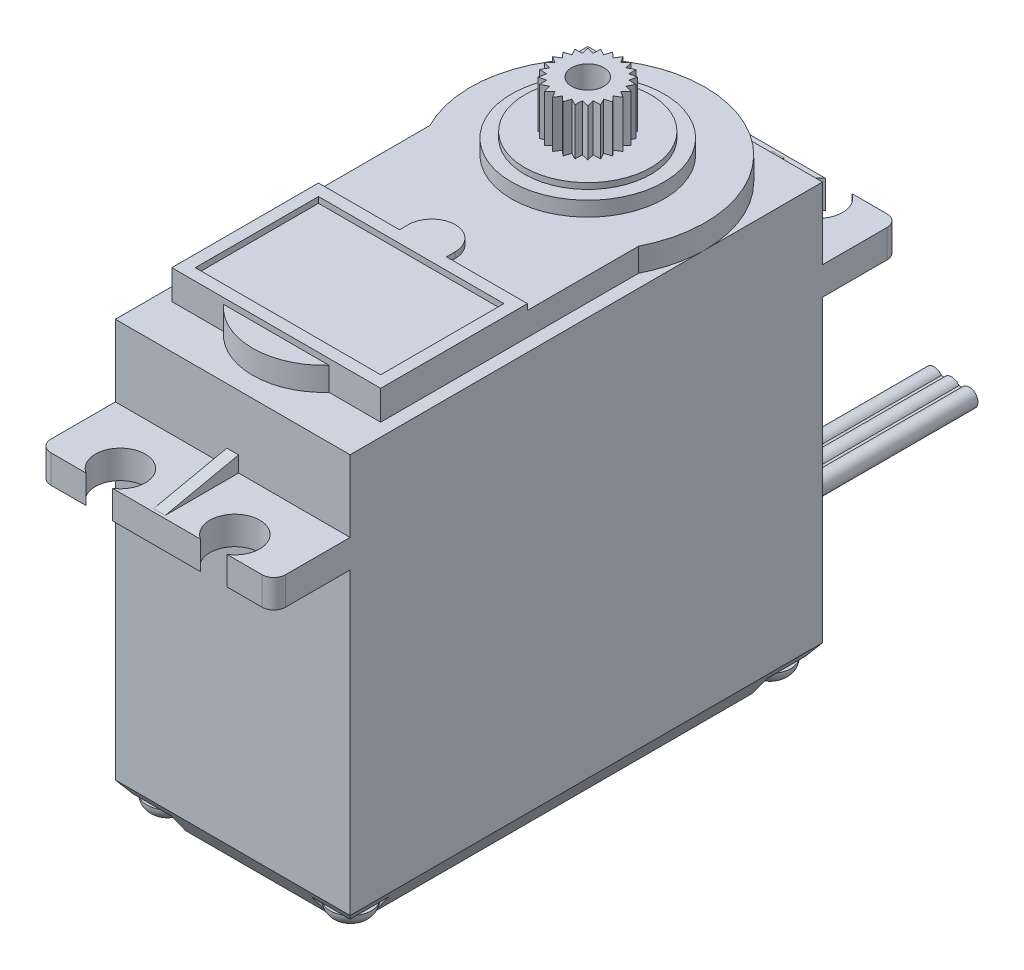
from build123d import *

# Parameters (mm, degrees)
SKETCH1_W            = 20
SKETCH1_H            = 40.25
BOSS_EXTRUDE1_DEPTH  = 18.375
BOSS_EXTRUDE2_DEPTH  = 2.4
BOSS_EXTRUDE3_DEPTH  = 0.5
BOSS_EXTRUDE4_DEPTH  = 2
SKETCH5_R            = 6.5
BOSS_EXTRUDE5_DEPTH  = 1.75
CUT_EXTRUDE1_START   = -0.5
SKETCH6_R            = 6.5
SKETCH6_R_2          = 5.375
CUT_EXTRUDE1_DEPTH   = 0.5
BOSS_EXTRUDE6_DEPTH  = 4
SKETCH8_R            = 1.375
CUT_EXTRUDE2_DEPTH   = 6
BOSS_EXTRUDE7_DEPTH  = 0.5
FILLET1_R            = 1
FILLET1_OF_MIRROR1_R = 1
CHAMFER1_SIZE        = 2
CHAMFER1_SIZE2       = 2.75
CUT_EXTRUDE3_DEPTH   = 1.75
MIRROR3_COPY_1_DEPTH = 1.75
MIRROR3_COPY_3_DEPTH = 1.75
SKETCH13_W           = 6.5
SKETCH13_H           = 4.25
BOSS_EXTRUDE8_DEPTH  = 1
BOSS_EXTRUDE10_DEPTH = 20


with BuildPart() as part:
    # Sketch1 → Boss-Extrude1 (new, symmetric)
    with BuildSketch(Plane(origin=(0, 0, 0), x_dir=(1, 0, 0), z_dir=(0, 1, 0))):
        Rectangle(SKETCH1_W, SKETCH1_H)
    extrude(amount=BOSS_EXTRUDE1_DEPTH, both=True)

    # Sketch2 → Boss-Extrude2 (add)
    with BuildSketch(Plane(origin=(0, 9.874999982, 0), x_dir=(1, 0, 0), z_dir=(0, 1, 0))):
        with BuildLine():
            Line((-10, -20.125), (-10, -26.625))
            Line((-10, -26.625), (-6, -26.625))
            ThreePointArc((-6, -26.625), (-4.875, -22.697224362), (-3.75, -26.625))
            Line((-3.75, -26.625), (3.75, -26.625))
            ThreePointArc((3.75, -26.625), (4.875, -22.697224362), (6, -26.625))
            Line((6, -26.625), (10, -26.625))
            Line((10, -26.625), (10, -20.125))
            Line((10, -20.125), (-10, -20.125))
        make_face()
    boss_extrude2 = extrude(amount=BOSS_EXTRUDE2_DEPTH)

    # Sketch3 → Boss-Extrude3 (add, symmetric)
    with BuildSketch(Plane(origin=(0, 0, 0), x_dir=(0, 0, -1), z_dir=(1, 0, 0))):
        Polygon((-20.125, 13.614999982), (-26.375, 12.274999982), (-20.125, 12.274999982), align=None)
    boss_extrude3 = extrude(amount=BOSS_EXTRUDE3_DEPTH, both=True)

    # Sketch4 → Boss-Extrude4 (add)
    with BuildSketch(Plane(origin=(0, 18.375, 0), x_dir=(1, 0, 0), z_dir=(0, 1, 0))):
        with BuildLine():
            ThreePointArc((-10, 10.125), (-9.721111048, 7.77979212), (-8.9, 5.565394754))
            Line((-8.9, 5.565394754), (-8.9, -16.418999275))
            Line((-8.9, -16.418999275), (-4.5, -16.418999275))
            ThreePointArc((-4.5, -16.418999275), (0, -18.418999275), (4.5, -16.418999275))
            Line((4.5, -16.418999275), (8.9, -16.418999275))
            Line((8.9, -16.418999275), (8.9, 5.565394754))
            ThreePointArc((8.9, 5.565394754), (9.721111051, 7.779792133), (10, 10.125000027))
            ThreePointArc((10, 10.125000027), (7.071067802, 17.196067821), (0, 20.125))
            ThreePointArc((0, 20.125), (-7.071067812, 17.196067812), (-10, 10.125))
        make_face()
    extrude(amount=BOSS_EXTRUDE4_DEPTH)

    # Sketch5 → Boss-Extrude5 (add)
    with BuildSketch(Plane(origin=(0, 20.375, 0), x_dir=(1, 0, 0), z_dir=(0, 1, 0))):
        with Locations((0, 10.125)):
            Circle(SKETCH5_R)
    extrude(amount=BOSS_EXTRUDE5_DEPTH)

    # Sketch6 → Cut-Extrude1 (cut)
    with BuildSketch(Plane(origin=(0, 22.125, 0), x_dir=(1, 0, 0), z_dir=(0, 1, 0)).offset(CUT_EXTRUDE1_START)):
        with Locations((0, 10.125)):
            Circle(SKETCH6_R)
        with Locations((0, 10.125)):
            Circle(SKETCH6_R_2, mode=Mode.SUBTRACT)
    extrude(amount=CUT_EXTRUDE1_DEPTH, mode=Mode.SUBTRACT)

    # Sketch7 → Boss-Extrude6 (add)
    with BuildSketch(Plane(origin=(0, 22.125, 0), x_dir=(1, 0, 0), z_dir=(0, 1, 0))):
        Polygon((0, 13.125), (-0.326315481, 12.603612153), (-0.776457135, 13.022777479), (-0.956708581, 12.434698831), (-1.5, 12.723076211), (-1.521903573, 12.108383351), (-2.121320344, 12.246320344), (-1.983383351, 11.646903573), (-2.598076211, 11.625), (-2.309698831, 11.081708581), (-2.897777479, 10.901457135), (-2.478612153, 10.451315481), (-3, 10.125), (-2.478612153, 9.798684519), (-2.897777479, 9.348542865), (-2.309698831, 9.168291419), (-2.598076211, 8.625), (-1.983383351, 8.603096427), (-2.121320344, 8.003679656), (-1.521903573, 8.141616649), (-1.5, 7.526923789), (-0.956708581, 7.815301169), (-0.776457135, 7.227222521), (-0.326315481, 7.646387847), (0, 7.125), (0.326315481, 7.646387847), (0.776457135, 7.227222521), (0.956708581, 7.815301169), (1.5, 7.526923789), (1.521903573, 8.141616649), (2.121320344, 8.003679656), (1.983383351, 8.603096427), (2.598076211, 8.625), (2.309698831, 9.168291419), (2.897777479, 9.348542865), (2.478612153, 9.798684519), (3, 10.125), (2.478612153, 10.451315481), (2.897777479, 10.901457135), (2.309698831, 11.081708581), (2.598076211, 11.625), (1.983383351, 11.646903573), (2.121320344, 12.246320344), (1.521903573, 12.108383351), (1.5, 12.723076211), (0.956708581, 12.434698831), (0.776457135, 13.022777479), (0.326315481, 12.603612153), align=None)
    extrude(amount=BOSS_EXTRUDE6_DEPTH)

    # Sketch8 → Cut-Extrude2 (cut)
    with BuildSketch(Plane(origin=(0, 26.125, 0), x_dir=(1, 0, 0), z_dir=(0, 1, 0))):
        with Locations((0, 10.125)):
            Circle(SKETCH8_R)
    extrude(amount=-CUT_EXTRUDE2_DEPTH, mode=Mode.SUBTRACT)

    # Sketch9 → Boss-Extrude7 (add)
    with BuildSketch(Plane(origin=(0, 20.375, 0), x_dir=(1, 0, 0), z_dir=(0, 1, 0))):
        with BuildLine():
            Line((8.9, -16.418999275), (-8.9, -16.418999275))
            Line((-8.9, -16.418999275), (-8.9, -3.918999275))
            Line((-8.9, -3.918999275), (-2, -3.918999275))
            Line((-2, -3.918999275), (-2, -3.168999275))
            ThreePointArc((-2, -3.168999275), (0, -1.168999275), (2, -3.168999275))
            Line((2, -3.168999275), (2, -3.918999275))
            Line((2, -3.918999275), (8.9, -3.918999275))
            Line((8.9, -3.918999275), (8.9, -16.418999275))
        make_face()
        Polygon((2, -4.918999275), (7.9, -4.918999275), (7.9, -15.418999275), (-7.9, -15.418999275), (-7.9, -4.918999275), (-2, -4.918999275), align=None, mode=Mode.SUBTRACT)
    extrude(amount=BOSS_EXTRUDE7_DEPTH)

    # Fillet1
    fillet1_edges = [part.edges().sort_by_distance(p)[0] for p in [
        (10, 11.074999982, 26.625),
        (-10, 11.074999982, 26.625),
    ]]
    fillet(fillet1_edges, radius=FILLET1_R)

    # Mirror1: Boss-Extrude2, Boss-Extrude3 across plane
    add(boss_extrude2.mirror(Plane.XY))
    add(boss_extrude3.mirror(Plane.XY))

    # Fillet1 of Mirror1
    fillet1_of_mirror1_edges = [part.edges().sort_by_distance(p)[0] for p in [
        (10, 11.074999982, -26.625),
        (-10, 11.074999982, -26.625),
    ]]
    fillet(fillet1_of_mirror1_edges, radius=FILLET1_OF_MIRROR1_R)

    # Chamfer1
    chamfer1_edges = [part.edges().sort_by_distance(p)[0] for p in [
        (0, -18.375, 20.125),
        (-10, -18.375, 0),
        (0, -18.375, -20.125),
        (10, -18.375, 0),
    ]]
    chamfer1_side = [part.faces().sort_by_distance(p)[0] for p in [
        (0, -18.375, 0),
    ]]
    chamfer(chamfer1_edges, length=CHAMFER1_SIZE, length2=CHAMFER1_SIZE2, reference=chamfer1_side[0])

    # Sketch10 → Cut-Extrude3 (cut)
    with BuildSketch(Plane.XZ.offset(18.375)):
        with BuildLine():
            Line((6, -20.125), (6, -18.125))
            ThreePointArc((6, -18.125), (6.585786438, -16.710786438), (8, -16.125))
            Line((8, -16.125), (10, -16.125))
            Line((10, -16.125), (10, -20.125))
            Line((10, -20.125), (6, -20.125))
        make_face()
    cut_extrude3 = extrude(amount=-CUT_EXTRUDE3_DEPTH, mode=Mode.SUBTRACT)

    # Sketch12 → Revolve1 (revolve)
    with BuildSketch(Plane(origin=(0, 0, -17.875), x_dir=(-1, 0, 0), z_dir=(0, 0, -1))):
        with BuildLine():
            Line((-7.8, -16.625), (-9.55, -16.625))
            ThreePointArc((-9.55, -16.625), (-9.220495129, -17.420495129), (-8.425, -17.75))
            Line((-8.425, -17.75), (-7.8, -17.75))
            Line((-7.8, -17.75), (-7.8, -16.625))
        make_face()
    revolve1 = revolve(axis=Axis((7.8, -17.75, -17.875), (0, 1, 0)))

    # Mirror2: Cut-Extrude3, Revolve1 across plane
    add(cut_extrude3.mirror(Plane(origin=(0, 0, 0), x_dir=(0, 0, 1), z_dir=(1, 0, 0))), mode=Mode.SUBTRACT)
    add(revolve1.mirror(Plane(origin=(0, 0, 0), x_dir=(0, 0, 1), z_dir=(1, 0, 0))))

    # Mirror3 copy 1 sketch → Mirror3 copy 1 (cut)
    with BuildSketch(Plane(origin=(0, -18.375, 0), x_dir=(-1, 0, 0), z_dir=(0, -1, 0))):
        with BuildLine():
            Line((6, -20.125), (6, -18.125))
            ThreePointArc((6, -18.125), (6.585786438, -16.710786438), (8, -16.125))
            Line((8, -16.125), (10, -16.125))
            Line((10, -16.125), (10, -20.125))
            Line((10, -20.125), (6, -20.125))
        make_face()
    extrude(amount=-MIRROR3_COPY_1_DEPTH, mode=Mode.SUBTRACT)

    # Mirror3 copy 2 sketch → Mirror3 copy 2 (revolve)
    with BuildSketch(Plane.XY.offset(17.875)):
        with BuildLine():
            Line((-7.8, -16.625), (-9.55, -16.625))
            ThreePointArc((-9.55, -16.625), (-9.220495129, -17.420495129), (-8.425, -17.75))
            Line((-8.425, -17.75), (-7.8, -17.75))
            Line((-7.8, -17.75), (-7.8, -16.625))
        make_face()
    revolve(axis=Axis((-7.8, -17.75, 17.875), (0, 1, 0)))

    # Mirror3 copy 3 sketch → Mirror3 copy 3 (cut)
    with BuildSketch(Plane.XZ.offset(18.375)):
        with BuildLine():
            Line((6, 20.125), (6, 18.125))
            ThreePointArc((6, 18.125), (6.585786438, 16.710786438), (8, 16.125))
            Line((8, 16.125), (10, 16.125))
            Line((10, 16.125), (10, 20.125))
            Line((10, 20.125), (6, 20.125))
        make_face()
    extrude(amount=-MIRROR3_COPY_3_DEPTH, mode=Mode.SUBTRACT)

    # Mirror3 copy 4 sketch → Mirror3 copy 4 (revolve)
    with BuildSketch(Plane(origin=(0, 0, 17.875), x_dir=(-1, 0, 0), z_dir=(0, 0, 1))):
        with BuildLine():
            Line((-7.8, 16.625), (-9.55, 16.625))
            ThreePointArc((-9.55, 16.625), (-9.220495129, 17.420495129), (-8.425, 17.75))
            Line((-8.425, 17.75), (-7.8, 17.75))
            Line((-7.8, 17.75), (-7.8, 16.625))
        make_face()
    revolve(axis=Axis((7.8, -17.75, 17.875), (0, -1, 0)))

    # Sketch13 → Boss-Extrude8 (add)
    with BuildSketch(Plane(origin=(0, 0, -20.125), x_dir=(-1, 0, 0), z_dir=(0, 0, -1))):
        with Locations((0, -12.25)):
            Rectangle(SKETCH13_W, SKETCH13_H)
    extrude(amount=BOSS_EXTRUDE8_DEPTH)

    # Sketch18 → Boss-Extrude10 (add)
    with BuildSketch(Plane(origin=(0, 0, -21.125), x_dir=(-1, 0, 0), z_dir=(0, 0, -1))):
        with BuildLine():
            Line((-0.875, -12.664578099), (-0.625, -12.664578099))
            ThreePointArc((-0.625, -12.664578099), (0, -13), (0.625, -12.664578099))
            Line((0.625, -12.664578099), (0.875, -12.664578099))
            ThreePointArc((0.875, -12.664578099), (2.25, -12.25), (0.875, -11.835421901))
            Line((0.875, -11.835421901), (0.625, -11.835421901))
            ThreePointArc((0.625, -11.835421901), (0, -11.5), (-0.625, -11.835421901))
            Line((-0.625, -11.835421901), (-0.875, -11.835421901))
            ThreePointArc((-0.875, -11.835421901), (-2.25, -12.25), (-0.875, -12.664578099))
        make_face()
    extrude(amount=BOSS_EXTRUDE10_DEPTH)

    # Sketch16 → Loft1 section 0
    with BuildSketch(Plane(origin=(0, 0, -25.125), x_dir=(-1, 0, 0), z_dir=(0, 0, -1))):
        with BuildLine():
            Line((-2.375, -13.125), (2.375, -13.125))
            Line((2.375, -13.125), (2.375, -11.375))
            Line((2.375, -11.375), (-2.375, -11.375))
            Line((-2.375, -11.375), (-2.375, -13.125))
        make_face()
    # Sketch15 → Loft1 section 1
    with BuildSketch(Plane(origin=(0, 0, -21.125), x_dir=(-1, 0, 0), z_dir=(0, 0, -1))):
        with BuildLine():
            Line((-2.75, -10.625), (-2.75, -13.875))
            Line((-2.75, -13.875), (2.75, -13.875))
            Line((2.75, -13.875), (2.75, -10.625))
            Line((2.75, -10.625), (-2.75, -10.625))
        make_face()
    loft()


solid = part.part
